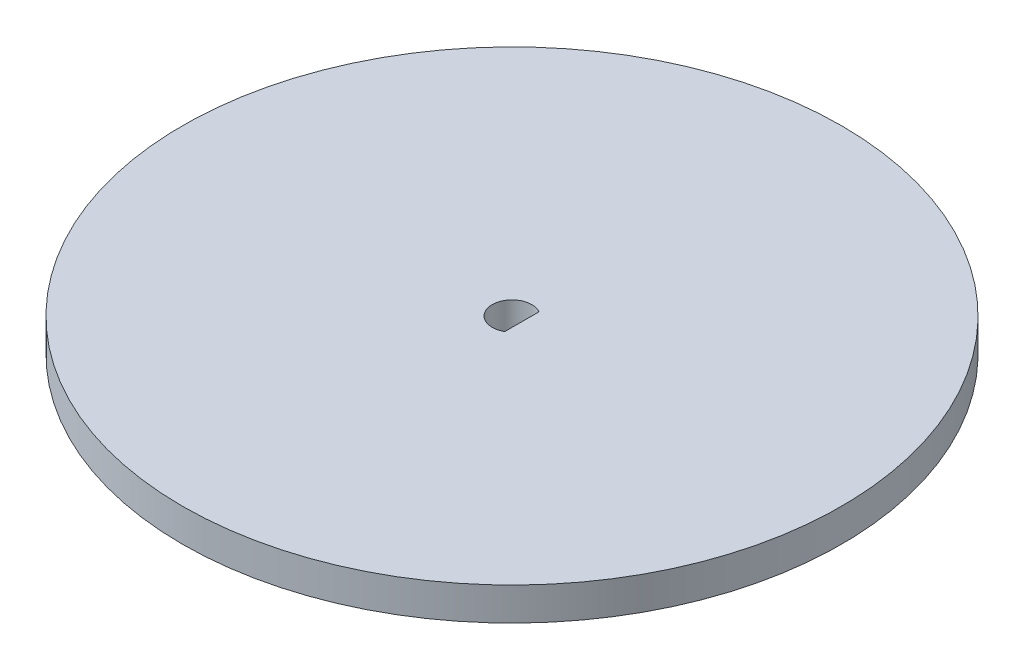
from build123d import *

# Parameters (mm, degrees)
SKETCH1_R           = 50
BOSS_EXTRUDE1_DEPTH = 5


with BuildPart() as part:
    # Sketch1 → Boss-Extrude1 (new body)
    with BuildSketch(Plane(origin=(0, 0, 0), x_dir=(1, 0, 0), z_dir=(0, 1, 0))):
        with Locations(Location((0, 0, 0), (0, 0, 270))):
            Circle(SKETCH1_R)
        with BuildLine():
            Line((1.5, 2.598076211), (1.5, -2.598076211))
            ThreePointArc((1.5, -2.598076211), (-3, 0), (1.5, 2.598076211))
        make_face(mode=Mode.SUBTRACT)
    extrude(amount=BOSS_EXTRUDE1_DEPTH)


solid = part.part
